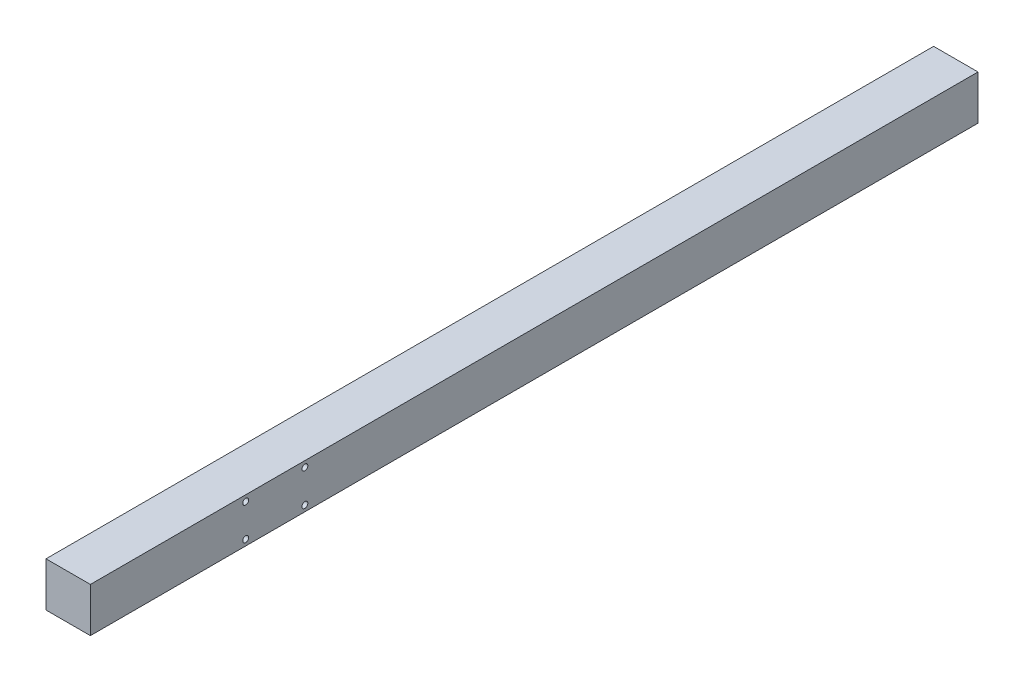
from build123d import *

# Parameters (mm, degrees)
SKETCH1_W             = 30
SKETCH1_H             = 30
BOSS_EXTRUDE1_DEPTH   = 600
SKETCH8_R             = 2.5
CUT_EXTRUDE7_DEPTH    = 30
F_4_0MM_DOWEL_HOLE1_D = 4


with BuildPart() as part:
    # Sketch1 → Boss-Extrude1 (new body)
    with BuildSketch(Plane.XY):
        Rectangle(SKETCH1_W, SKETCH1_H)
    extrude(amount=BOSS_EXTRUDE1_DEPTH)

    # Sketch8 → Cut-Extrude7 (cut)
    with BuildSketch(Plane(origin=(0, 0, 0), x_dir=(-1, 0, 0), z_dir=(0, 0, -1))):
        with Locations((-10, 10)):
            Circle(SKETCH8_R)
        with Locations((10, 10)):
            Circle(SKETCH8_R)
        with Locations((10, -10)):
            Circle(SKETCH8_R)
        with Locations((-10, -10)):
            Circle(SKETCH8_R)
    extrude(amount=-CUT_EXTRUDE7_DEPTH, mode=Mode.SUBTRACT)

    # Ø4.0mm Dowel Hole1 (through all)
    with Locations(Plane(origin=(-15, 11, 495), x_dir=(0, -1, 0), z_dir=(-1, 0, 0))):
        with Locations((0, 0), (0, -40), (22, -40), (22, 0)):
            Hole(F_4_0MM_DOWEL_HOLE1_D / 2)


solid = part.part
